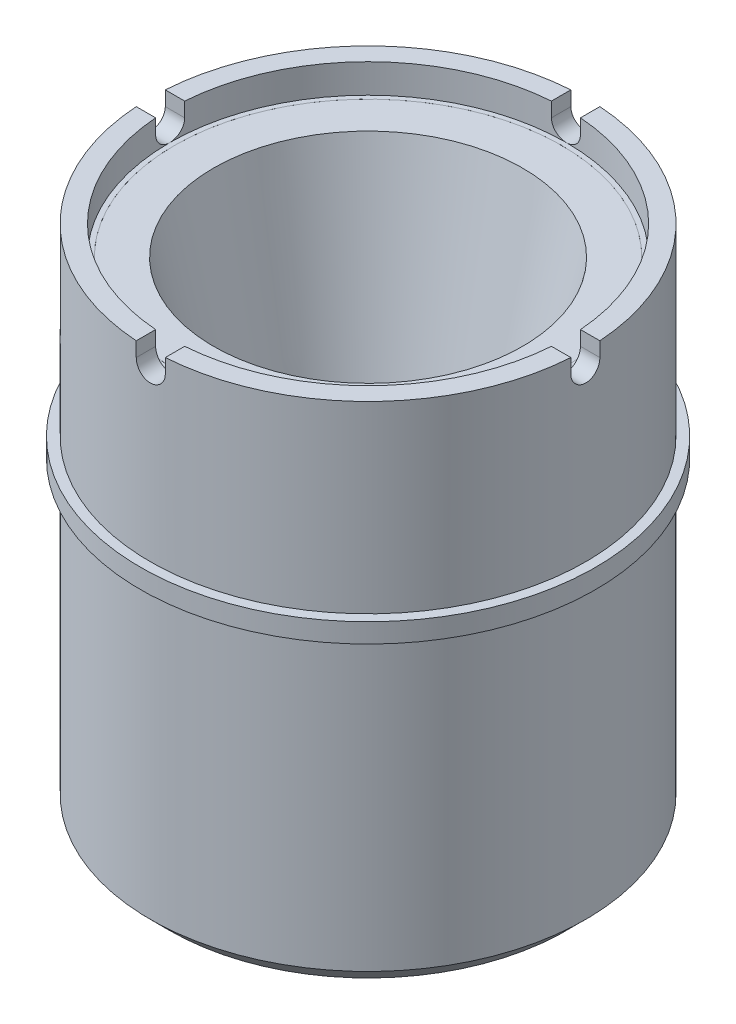
from build123d import *

# Parameters (mm, degrees)
SKETCH_1_W               = 1
SKETCH_1_H               = 2
SKETCH_1_W_2             = 2
SKETCH_1_H_2             = 3
CUT_EXTRUDE_1_REACH      = 64.558
CUT_EXTRUDE_1_END_RADIUS = 22.5
PATTERN_CIRCULAR_1_COUNT = 4
CHAMFER_1_SIZE           = 2


with BuildPart() as part:
    # 草图1 → Revolve 2249 (revolve)
    with BuildSketch(Plane.XY, mode=Mode.PRIVATE) as revolve_2249_sk:
        Polygon((19, 4), (0, 4), (0, 0), (22.5, 0), (22.5, 50), (20, 50), (20, 48), (19, 48), align=None)
        with Locations((18.5, 5)):
            Rectangle(SKETCH_1_W, SKETCH_1_H)
        with Locations((21.5, 51.5)):
            Rectangle(SKETCH_1_W_2, SKETCH_1_H_2)
        with Locations((23, 33)):
            Rectangle(SKETCH_1_W, SKETCH_1_H)
    revolve(revolve_2249_sk.sketch.rotate(Axis((0, 0, 0), (0, 1, 0)), 90), axis=Axis((0, 0, 0), (0, 1, 0)))

    # 切除-拉伸1: up to this cylinder (the profile starts inside it)
    cut_extrude_1_end = Plane(origin=(0, 51.640025, 0), z_dir=(0, -1, 0)) * Cylinder(CUT_EXTRUDE_1_END_RADIUS, 175.116, mode=Mode.PRIVATE)
    # 草图4 → 切除-拉伸1 (cut, up to the surface)
    with BuildSketch(Plane.XY, mode=Mode.PRIVATE) as cut_extrude_1_sk1:
        with BuildLine():
            Line((0, 50), (0, 53))
            Line((0, 53), (-1.5, 53))
            Line((-1.5, 53), (-1.5, 51.5))
            ThreePointArc((-1.5, 51.5), (-1.060660172, 50.439339828), (0, 50))
        make_face()
    cut_extrude_1_tool1 = extrude(cut_extrude_1_sk1.sketch, amount=-CUT_EXTRUDE_1_REACH, mode=Mode.PRIVATE) & cut_extrude_1_end
    # 草图4 → 切除-拉伸1 (cut, up to the surface)
    with BuildSketch(Plane.XY, mode=Mode.PRIVATE) as cut_extrude_1_sk2:
        with BuildLine():
            Line((1.5, 53), (0, 53))
            Line((0, 53), (0, 50))
            ThreePointArc((0, 50), (1.060660172, 50.439339828), (1.5, 51.5))
            Line((1.5, 51.5), (1.5, 53))
        make_face()
    cut_extrude_1_tool2 = extrude(cut_extrude_1_sk2.sketch, amount=-CUT_EXTRUDE_1_REACH, mode=Mode.PRIVATE) & cut_extrude_1_end
    cut_extrude_1 = cut_extrude_1_tool1.solids().sort_by_distance((-0.700124, 51.640025, 0))[0] + cut_extrude_1_tool2.solids().sort_by_distance((0.700124, 51.640025, 0))[0]
    add(cut_extrude_1, mode=Mode.SUBTRACT)

    # 阵列(圆周)1: 切除-拉伸1 ×4 about axis
    pattern_circular_1_axis = Axis((0, 0, 0), (0, 1, 0))
    for i in range(1, PATTERN_CIRCULAR_1_COUNT):
        add(cut_extrude_1.rotate(pattern_circular_1_axis, i * 360 / PATTERN_CIRCULAR_1_COUNT), mode=Mode.SUBTRACT)

    # 倒角1
    chamfer_1_edges = [part.edges().sort_by_distance(p)[0] for p in [
        (0, 0, 22.5),
    ]]
    chamfer(chamfer_1_edges, length=CHAMFER_1_SIZE)


with BuildPart() as body_2:
    # 草图2 → Revolve 2487 (revolve)
    with BuildSketch(Plane.XY):
        with BuildLine():
            Line((19, 13), (19, 25.5))
            Line((19, 25.5), (12.5, 25.5))
            ThreePointArc((12.5, 25.5), (8.838834765, 16.661165235), (0, 13))
            Line((0, 13), (0, 4))
            Line((0, 4), (18, 4))
            Line((18, 4), (18, 6))
            Line((18, 6), (19, 6))
            Line((19, 6), (19, 13))
        make_face()
    revolve(axis=Axis((0, 0, 0), (0, 1, 0)))


with BuildPart() as body_3:
    # 草图3 → Revolve 2685 (revolve)
    with BuildSketch(Plane.XY, mode=Mode.PRIVATE) as revolve_2685_sk:
        with BuildLine():
            Line((19, 48), (20, 48))
            Line((20, 48), (20, 50))
            Line((20, 50), (15.964343174, 50))
            Line((15.964343174, 50), (11.600401101, 30.156253246))
            ThreePointArc((11.600401101, 30.156253246), (12.273039839, 27.871179689), (12.5, 25.5))
            Line((12.5, 25.5), (19, 25.5))
            Line((19, 25.5), (19, 48))
        make_face()
    revolve(revolve_2685_sk.sketch.rotate(Axis((0, 50, 0), (0, -1, 0)), 180), axis=Axis((0, 50, 0), (0, -1, 0)))


solid = Compound([part.part, body_2.part, body_3.part])
